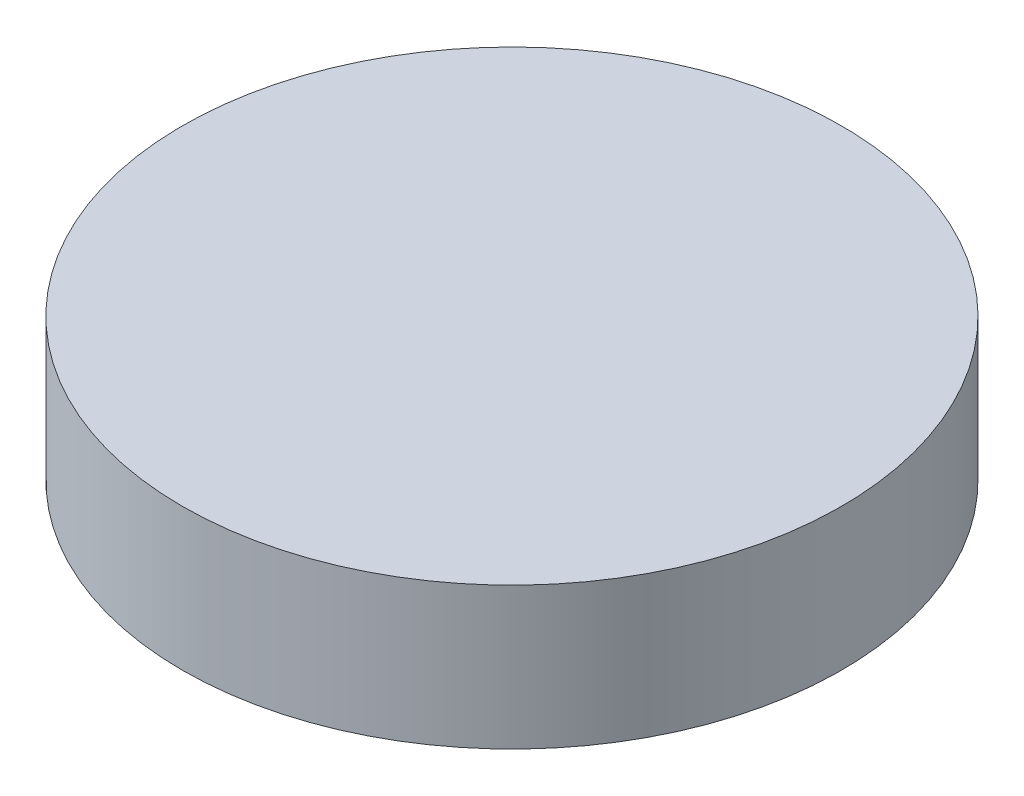
from build123d import *

# Parameters (mm, degrees)
SKETCH1_R           = 13.93
BOSS_EXTRUDE1_DEPTH = 6


with BuildPart() as part:
    # Sketch1 → Boss-Extrude1 (new body)
    with BuildSketch(Plane(origin=(0, 0, 0), x_dir=(1, 0, 0), z_dir=(0, 1, 0))):
        with Locations(Location((0, 0, 0), (0, 0, 270))):
            Circle(SKETCH1_R)
    extrude(amount=BOSS_EXTRUDE1_DEPTH)


solid = part.part
